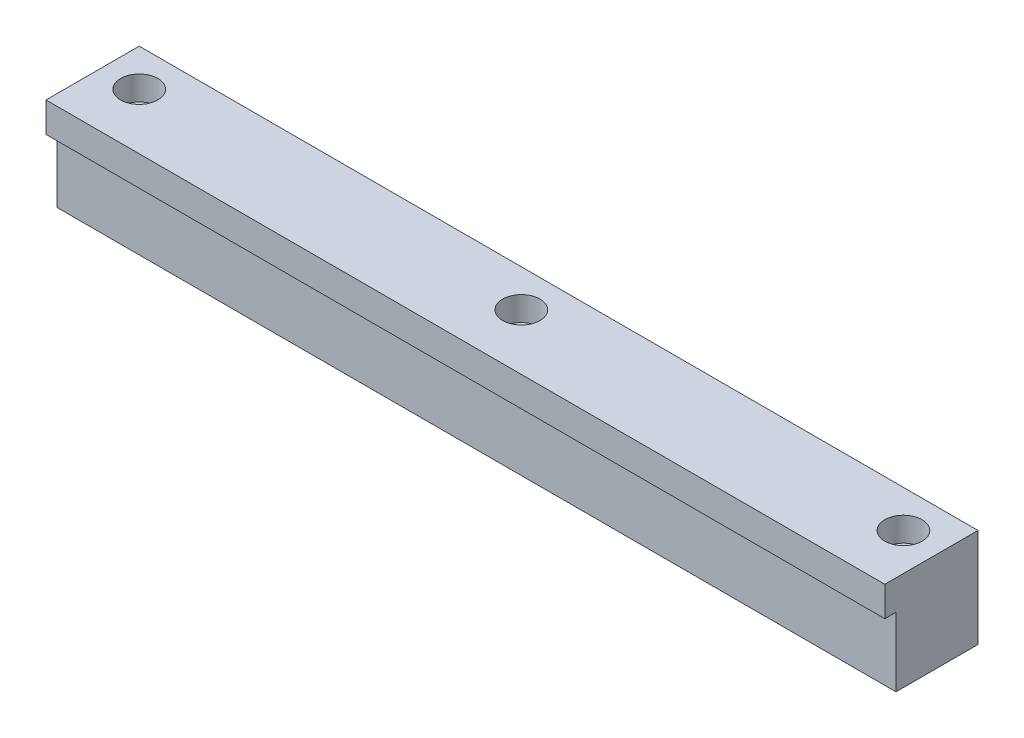
from build123d import *

# Parameters (mm, degrees)
EXTRUDE_1_DEPTH          = 225
EXTRUDE_1_DEPTH_BACK     = 225
CUT_EXTRUDE_1_DEPTH      = 233.505913903
CUT_EXTRUDE_1_DEPTH_BACK = 233.505913903
SKETCH_2_R               = 7
SKETCH_4_R               = 10
CUT_EXTRUDE_2_DEPTH      = 13
SKETCH_6_R               = 6
CUT_EXTRUDE_4_DEPTH      = 15


with BuildPart() as part:
    # ｽｹｯﾁ1 → ﾎﾞｽ - 押し出し1 (new, two sides: drawn at the far end of the back side and taken through both)
    with BuildSketch(Plane(origin=(0, 0, 0), x_dir=(0, 0, -1), z_dir=(1, 0, 0)).offset(-EXTRUDE_1_DEPTH_BACK)):
        Polygon((-19, 0), (25, 0), (25, 53), (-25, 53), (-25, 37), (-19, 37), align=None)
    extrude(amount=EXTRUDE_1_DEPTH + EXTRUDE_1_DEPTH_BACK)

    # ｽｹｯﾁ2 → ｶｯﾄ - 押し出し1 (cut, two sides: drawn at the far end of the back side and taken through both)
    with BuildSketch(Plane(origin=(0, 0, 0), x_dir=(1, 0, 0), z_dir=(0, 1, 0)).offset(-CUT_EXTRUDE_1_DEPTH_BACK)):
        with Locations((-205, 5)):
            Circle(SKETCH_2_R)
        with Locations((0, 5)):
            Circle(SKETCH_2_R)
        with Locations((205, 5)):
            Circle(SKETCH_2_R)
    extrude(amount=CUT_EXTRUDE_1_DEPTH + CUT_EXTRUDE_1_DEPTH_BACK, mode=Mode.SUBTRACT)

    # ｽｹｯﾁ4 → ｶｯﾄ - 押し出し2 (cut)
    with BuildSketch(Plane(origin=(0, 53, 0), x_dir=(1, 0, 0), z_dir=(0, 1, 0))):
        with Locations((-205, 5)):
            Circle(SKETCH_4_R)
        with Locations((0, 5)):
            Circle(SKETCH_4_R)
        with Locations((205, 5)):
            Circle(SKETCH_4_R)
    extrude(amount=-CUT_EXTRUDE_2_DEPTH, mode=Mode.SUBTRACT)

    # ｽｹｯﾁ6 → ｶｯﾄ - 押し出し4 (cut)
    with BuildSketch(Plane(origin=(0, 0, 0), x_dir=(1, 0, 0), z_dir=(0, 1, 0))):
        with Locations((-185, 5)):
            Circle(SKETCH_6_R)
        with Locations((185, 5)):
            Circle(SKETCH_6_R)
    extrude(amount=CUT_EXTRUDE_4_DEPTH, mode=Mode.SUBTRACT)


solid = part.part
